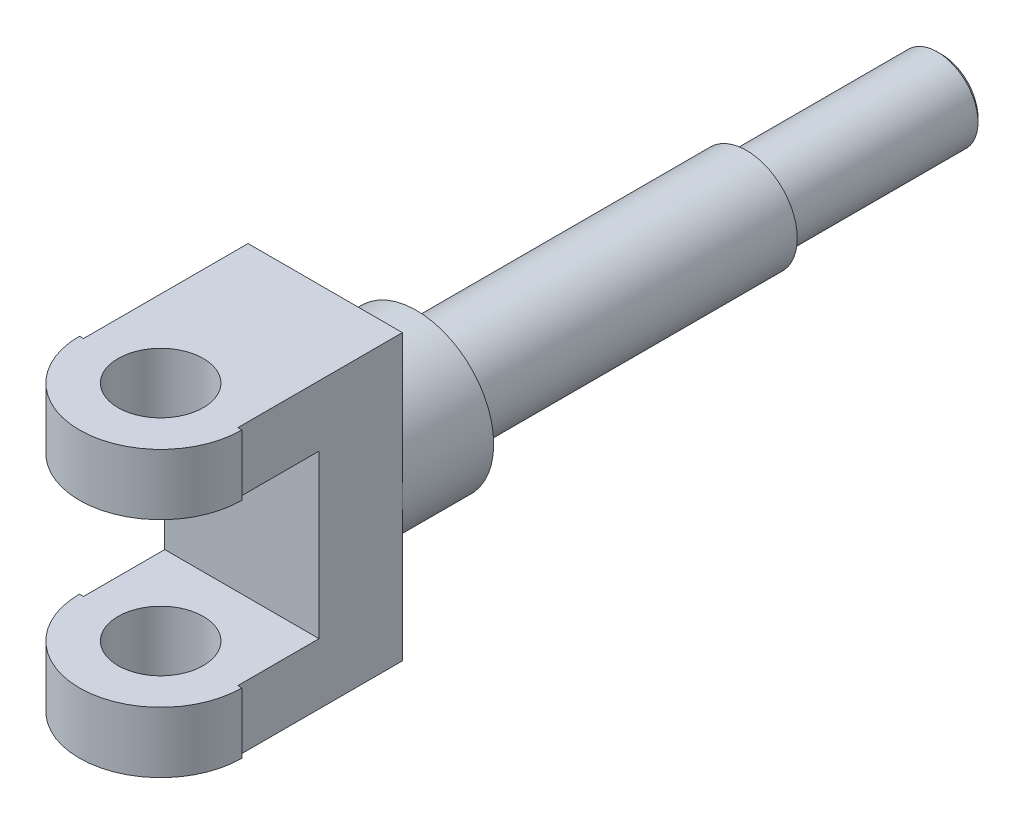
from build123d import *
from build123d.topology import SkipClean

# Parameters (mm, degrees)
ESQUISSE2_R             = 10
BOSS_EXTRU_1_DEPTH      = 48
ESQUISSE3_R             = 12.5
BOSS_EXTRU_2_DEPTH      = 81.25
CHANFREIN1_SIZE         = 1
ESQUISSE6_R             = 19
BOSS_EXTRU_3_DEPTH      = 60
BOSS_EXTRU_4_DEPTH      = 35
BOSS_EXTRU_4_DEPTH_BACK = 35
ESQUISSE7_W             = 38
ESQUISSE7_H             = 40.519603535
ENL_V_MAT_EXTRU_3_REACH = 207.478
BOSS_EXTRU_6_DEPTH      = 15
ESQUISSE16_W            = 38
ESQUISSE16_H            = 40
ENL_V_MAT_EXTRU_4_DEPTH = 20


with BuildPart() as part:
    # Esquisse2 → Boss.-Extru.1 (new body)
    with BuildSketch(Plane.XY):
        Circle(ESQUISSE2_R)
    extrude(amount=BOSS_EXTRU_1_DEPTH)

    # Esquisse3 → Boss.-Extru.2 (add)
    with BuildSketch(Plane.XY.offset(48)):
        Circle(ESQUISSE3_R)
    extrude(amount=BOSS_EXTRU_2_DEPTH)

    # Chanfrein1
    chanfrein1_edges = [part.edges().sort_by_distance(p)[0] for p in [
        (-10, 0, 0),
    ]]
    chamfer(chanfrein1_edges, length=CHANFREIN1_SIZE)

    # Esquisse6 → Boss.-Extru.3 (add)
    with BuildSketch(Plane.XY.offset(129.25)):
        Circle(ESQUISSE6_R)
    extrude(amount=BOSS_EXTRU_3_DEPTH)

    # Esquisse7 → Boss.-Extru.4 (add, two sides: drawn at the far end of the back side and taken through both)
    with BuildSketch(Plane(origin=(0, 0, 0), x_dir=(1, 0, 0), z_dir=(0, 1, 0)).offset(-BOSS_EXTRU_4_DEPTH_BACK)):
        with Locations((0, -171.990198233)):
            Rectangle(ESQUISSE7_W, ESQUISSE7_H)
    extrude(amount=BOSS_EXTRU_4_DEPTH + BOSS_EXTRU_4_DEPTH_BACK)

    # Esquisse12 → Enlèv. mat.-Extru.3 (cut, up to next)
    with BuildSketch(Plane(origin=(0, 35, 0), x_dir=(1, 0, 0), z_dir=(0, 1, 0)), mode=Mode.PRIVATE) as enl_v_mat_extru_3_sk1:
        with BuildLine():
            Line((-10.5, -192.25), (10.5, -192.25))
            ThreePointArc((10.5, -192.25), (0, -181.75), (-10.5, -192.25))
        make_face()
    enl_v_mat_extru_3_tool1 = extrude(enl_v_mat_extru_3_sk1.sketch, amount=-ENL_V_MAT_EXTRU_3_REACH, mode=Mode.PRIVATE) & part.part
    add(enl_v_mat_extru_3_tool1.solids().sort_by_distance((0, 35, 187.793662))[0], mode=Mode.SUBTRACT)

    # Esquisse15 → Boss.-Extru.6 (add)
    with BuildSketch(Plane(origin=(0, 35, 0), x_dir=(1, 0, 0), z_dir=(0, 1, 0))):
        with BuildLine():
            Line((-20, -192.25), (-10.5, -192.25))
            ThreePointArc((-10.5, -192.25), (0, -202.75), (10.5, -192.25))
            Line((10.5, -192.25), (20, -192.25))
            ThreePointArc((20, -192.25), (0, -212.25), (-20, -192.25))
        make_face()
    boss_extru_6 = extrude(amount=-BOSS_EXTRU_6_DEPTH)

    # Esquisse16 → Enlèv. mat.-Extru.4 (cut)
    with BuildSketch(Plane.XY.offset(192.25)):
        Rectangle(ESQUISSE16_W, ESQUISSE16_H)
    extrude(amount=-ENL_V_MAT_EXTRU_4_DEPTH, mode=Mode.SUBTRACT)

    # Symétrie2: Boss.-Extru.6 across plane
    with SkipClean():  # the faces are left unmerged after this step: merging them gives an invalid solid
        add(boss_extru_6.mirror(Plane.ZX))


solid = part.part
